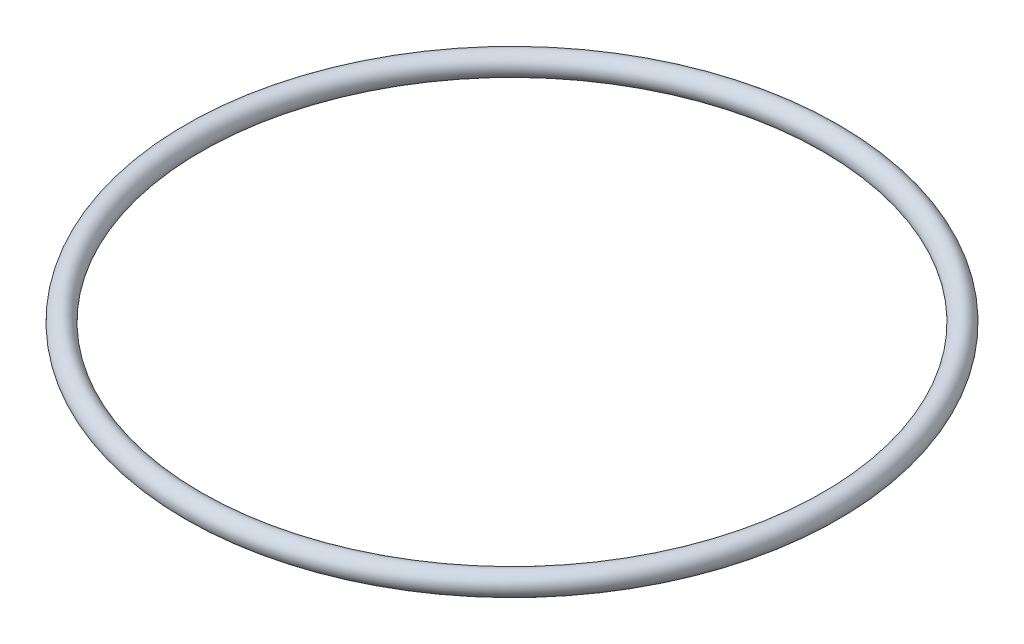
from build123d import *

# Parameters (mm, degrees)
SKETCH1_R = 1.5875


with BuildPart() as part:
    # Sketch1 → Revolve1 (revolve)
    with BuildSketch(Plane.XY, mode=Mode.PRIVATE) as revolve1_sk:
        with Locations((-46.0375, 0)):
            Circle(SKETCH1_R)
    revolve(revolve1_sk.sketch.rotate(Axis((0, 0, 0), (0, 1, 0)), 270), axis=Axis((0, 0, 0), (0, 1, 0)))


solid = part.part
